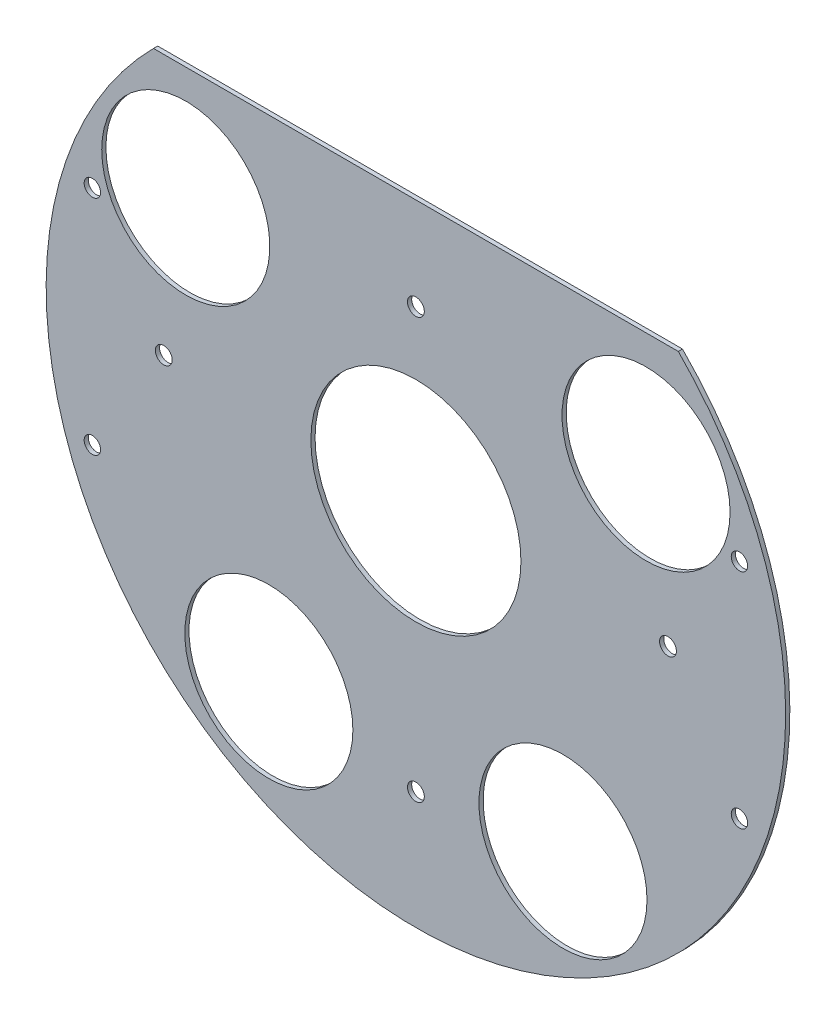
from build123d import *

# Parameters (mm, degrees)
SKETCH_1_R              = 25
SKETCH_1_R_2            = 20
EXTRUDE_1_DEPTH         = 1
HOLE_WIZARD_3_9_3_9_1_D = 3.9
SKETCH_4_R              = 2
CUT_EXTRUDE_1_DEPTH     = 10


with BuildPart() as part:
    # 草图1 → 凸台-拉伸1 (new body)
    with BuildSketch(Plane.XY):
        with BuildLine():
            Line((-62.449979984, 62), (62.449979984, 62))
            ThreePointArc((62.449979984, 62), (0, -88), (-62.449979984, 62))
        make_face()
        Circle(SKETCH_1_R, mode=Mode.SUBTRACT)
        with Locations((54.772, 35)):
            Circle(SKETCH_1_R_2, mode=Mode.SUBTRACT)
        with Locations(Location((-54.772, 35, 0), (0, 0, 180))):
            Circle(SKETCH_1_R_2, mode=Mode.SUBTRACT)
        with Locations((35, -54.772255751)):
            Circle(SKETCH_1_R_2, mode=Mode.SUBTRACT)
        with Locations((-35, -54.772255751)):
            Circle(SKETCH_1_R_2, mode=Mode.SUBTRACT)
    extrude(amount=EXTRUDE_1_DEPTH)

    # Ø3.9 (3.9) 直径孔1 (through all)
    with Locations(Plane(origin=(0, 0, 0), x_dir=(-1, 0, 0), z_dir=(0, 0, -1))):
        with Locations((-77, 26), (-77, -27), (77, -27), (77, 26)):
            Hole(HOLE_WIZARD_3_9_3_9_1_D / 2)

    # 草图4 → 切除-拉伸1 (cut)
    with BuildSketch(Plane.XY.offset(1)):
        with Locations((-60, 0)):
            Circle(SKETCH_4_R)
        with Locations((0, 40)):
            Circle(SKETCH_4_R)
        with Locations((60, 0)):
            Circle(SKETCH_4_R)
        with Locations((0, -60)):
            Circle(SKETCH_4_R)
    extrude(amount=-CUT_EXTRUDE_1_DEPTH, mode=Mode.SUBTRACT)


solid = part.part
